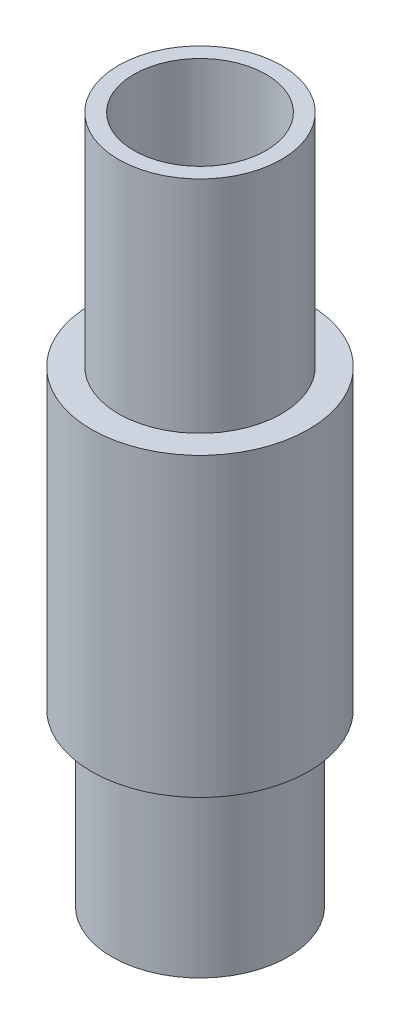
from build123d import *


with BuildPart() as part:
    # Sketch1 → Revolve1 (revolve)
    with BuildSketch(Plane.XY, mode=Mode.PRIVATE) as revolve1_sk:
        Polygon((5.05, 11), (5.05, 10), (5.85, 10), (5.8, 0), (8, 0), (8, 15.5), (9.85, 15.5), (9.85, 42.4), (7.4, 42.4), (7.4, 62.4), (6, 62.4), (6, 11.95), align=None)
    revolve(revolve1_sk.sketch.rotate(Axis((0, 0, 0), (0, 1, 0)), 90), axis=Axis((0, 0, 0), (0, 1, 0)))


solid = part.part
